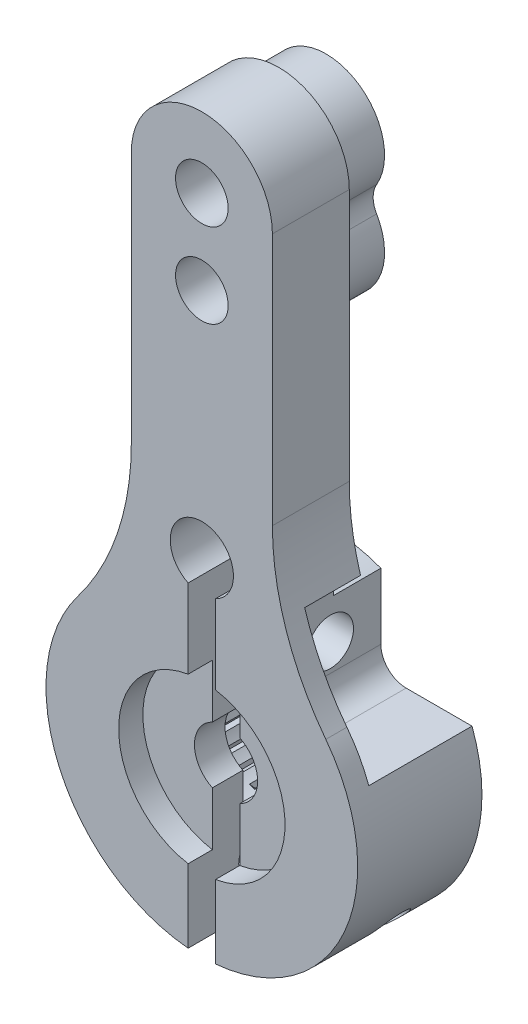
from build123d import *
from build123d.topology import SkipClean

# Parameters (mm, degrees)
BOSS_EXTRUDE1_DEPTH         = 3.65
F_3_0_3_DIAMETER_HOLE1_D    = 3
TAP_DRILL_FOR_M3X0_5_TAP1_D = 2.5
BOSS_EXTRUDE3_START         = 2.25
SKETCH10_R                  = 1.5
BOSS_EXTRUDE3_DEPTH         = 2.25
SKETCH9_W                   = 1.3
SKETCH9_H                   = 16.740891064
CUT_EXTRUDE2_DEPTH          = 29.941190369
SKETCH11_W                  = 6.665728158
SKETCH11_H                  = 5.8
CUT_EXTRUDE3_DEPTH          = 4.9
CIRPATTERN3_COUNT           = 2
M2_CLEARANCE_HOLE1_D        = 2.2
M2_CLEARANCE_HOLE1_DEPTH    = 1.95
M2_CLEARANCE_HOLE2_D        = 2.2
M2_CLEARANCE_HOLE2_DEPTH    = 1.95
TAP_DRILL_FOR_M2X0_4_TAP1_D = 1.6
TAP_DRILL_FOR_M2X0_4_TAP2_D = 1.6
FILLET3_R                   = 1.2
SKETCH8_R                   = 3.95
CUT_EXTRUDE1_DEPTH          = 1.15
SKETCH17_R                  = 2.95
BOSS_EXTRUDE4_DEPTH         = 3.3
BOSS_EXTRUDE5_DEPTH         = 3
DRAFT2_ANGLE                = -45
CIRPATTERN4_COUNT           = 25
FILLET4_R                   = 1.2


with BuildPart() as part:
    # Sketch1 → Boss-Extrude1 (new body)
    with BuildSketch(Plane.XY):
        with BuildLine():
            Line((-3.35, 24), (-3.35, 12))
            ThreePointArc((-3.35, 12), (-4.001241595, 8.033856538), (-5.886575957, 4.484219386))
            ThreePointArc((-5.886575957, 4.484219386), (0, -7.4), (5.886575957, 4.484219386))
            ThreePointArc((5.886575957, 4.484219386), (4.001241595, 8.033856538), (3.35, 12))
            Line((3.35, 12), (3.35, 24))
            ThreePointArc((3.35, 24), (0, 27.35), (-3.35, 24))
        make_face()
    extrude(amount=BOSS_EXTRUDE1_DEPTH)

    # Ø3.0 (3) Diameter Hole1 (through all)
    with Locations(Plane.XY.offset(3.65)):
        with Locations((0, 0), (0, 9)):
            Hole(F_3_0_3_DIAMETER_HOLE1_D / 2)

    # Tap Drill for M3x0.5 Tap1 (through all)
    with Locations(Plane.XY.offset(3.65)):
        with Locations((0, 24), (0, 20)):
            Hole(TAP_DRILL_FOR_M3X0_5_TAP1_D / 2)

    # Sketch10 → Boss-Extrude3 (add)
    # profile 1 of 7: a face of its own
    with SkipClean():  # the faces are left unmerged after this step: merging them gives an invalid solid
        with BuildSketch(Plane(origin=(0, 0, 0), x_dir=(-1, 0, 0), z_dir=(0, 0, -1)).offset(BOSS_EXTRUDE3_START)):
            with BuildLine():
                ThreePointArc((-1.92370086, 22), (-1.132337986, 22.53346318), (-0.207040964, 22.767265625))
                ThreePointArc((-0.207040964, 22.767265625), (-0.807371908, 24.954280149), (1.25, 24))
                ThreePointArc((1.25, 24), (0.954280149, 23.192628092), (0.207040964, 22.767265625))
                ThreePointArc((0.207040964, 22.767265625), (1.132337986, 22.53346318), (1.92370086, 22))
                ThreePointArc((1.92370086, 22), (2.553320866, 22.913180072), (2.775, 24))
                ThreePointArc((2.775, 24), (0, 26.775), (-2.775, 24))
                ThreePointArc((-2.775, 24), (-2.553320866, 22.913180072), (-1.92370086, 22))
            make_face()
        # profile 2 of 7: a face of its own
        with BuildSketch(Plane(origin=(0, 0, 0), x_dir=(-1, 0, 0), z_dir=(0, 0, -1)).offset(BOSS_EXTRUDE3_START)):
            with BuildLine():
                ThreePointArc((-0.207040964, 21.232734375), (-1.132337986, 21.46653682), (-1.92370086, 22))
                ThreePointArc((-1.92370086, 22), (-2.553320866, 21.086819928), (-2.775, 20))
                ThreePointArc((-2.775, 20), (0, 17.225), (2.775, 20))
                ThreePointArc((2.775, 20), (2.553320866, 21.086819928), (1.92370086, 22))
                ThreePointArc((1.92370086, 22), (1.132337986, 21.46653682), (0.207040964, 21.232734375))
                ThreePointArc((0.207040964, 21.232734375), (0.954280149, 20.807371908), (1.25, 20))
                ThreePointArc((1.25, 20), (-0.807371908, 19.045719851), (-0.207040964, 21.232734375))
            make_face()
        # profile 3 of 7: a face of its own
        with BuildSketch(Plane(origin=(0, 0, 0), x_dir=(-1, 0, 0), z_dir=(0, 0, -1)).offset(BOSS_EXTRUDE3_START)):
            with BuildLine():
                ThreePointArc((0.207040964, 22.767265625), (0.103879813, 22.754323885), (0, 22.75))
                Line((0, 22.75), (0, 21.25))
                ThreePointArc((0, 21.25), (0.103879813, 21.245676115), (0.207040964, 21.232734375))
                ThreePointArc((0.207040964, 21.232734375), (1.132337986, 21.46653682), (1.92370086, 22))
                ThreePointArc((1.92370086, 22), (1.132337986, 22.53346318), (0.207040964, 22.767265625))
            make_face()
        # profile 4 of 7: a face of its own
        with BuildSketch(Plane(origin=(0, 0, 0), x_dir=(-1, 0, 0), z_dir=(0, 0, -1)).offset(BOSS_EXTRUDE3_START)):
            with BuildLine():
                Line((0, 21.25), (0, 22.75))
                ThreePointArc((0, 22.75), (-0.103879813, 22.754323885), (-0.207040964, 22.767265625))
                ThreePointArc((-0.207040964, 22.767265625), (-1.132337986, 22.53346318), (-1.92370086, 22))
                ThreePointArc((-1.92370086, 22), (-1.132337986, 21.46653682), (-0.207040964, 21.232734375))
                ThreePointArc((-0.207040964, 21.232734375), (-0.103879813, 21.245676115), (0, 21.25))
            make_face()
        # profile 5 of 7: a face of its own
        with BuildSketch(Plane(origin=(0, 0, 0), x_dir=(-1, 0, 0), z_dir=(0, 0, -1)).offset(BOSS_EXTRUDE3_START)):
            with BuildLine():
                ThreePointArc((0.207040964, 22.767265625), (0.103879813, 22.754323885), (0, 22.75))
                Line((0, 22.75), (0, 21.25))
                ThreePointArc((0, 21.25), (0.103879813, 21.245676115), (0.207040964, 21.232734375))
                ThreePointArc((0.207040964, 21.232734375), (1.132337986, 21.46653682), (1.92370086, 22))
                ThreePointArc((1.92370086, 22), (1.132337986, 22.53346318), (0.207040964, 22.767265625))
            make_face()
        # profile 6 of 7: a face of its own
        with BuildSketch(Plane(origin=(0, 0, 0), x_dir=(-1, 0, 0), z_dir=(0, 0, -1)).offset(BOSS_EXTRUDE3_START)):
            with BuildLine():
                Line((0, 21.25), (0, 22.75))
                ThreePointArc((0, 22.75), (-0.103879813, 22.754323885), (-0.207040964, 22.767265625))
                ThreePointArc((-0.207040964, 22.767265625), (-1.132337986, 22.53346318), (-1.92370086, 22))
                ThreePointArc((-1.92370086, 22), (-1.132337986, 21.46653682), (-0.207040964, 21.232734375))
                ThreePointArc((-0.207040964, 21.232734375), (-0.103879813, 21.245676115), (0, 21.25))
            make_face()
        # profile 7 of 7: a face of its own
        with BuildSketch(Plane(origin=(0, 0, 0), x_dir=(-1, 0, 0), z_dir=(0, 0, -1)).offset(BOSS_EXTRUDE3_START)):
            with BuildLine():
                ThreePointArc((-5.886575957, 4.484219386), (-2.366361967, -7.011442865), (7.4, 0))
                ThreePointArc((7.4, 0), (7.011442865, 2.366361967), (5.886575957, 4.484219386))
                ThreePointArc((5.886575957, 4.484219386), (0, 7.4), (-5.886575957, 4.484219386))
            make_face()
            with Locations(Location((0, 0, 0), (0, 0, 180))):
                Circle(SKETCH10_R, mode=Mode.SUBTRACT)
        extrude(amount=-BOSS_EXTRUDE3_DEPTH)

    # Sketch9 → Cut-Extrude2 (cut, through all)
    with SkipClean():  # the faces are left unmerged after this step: merging them gives an invalid solid
        with BuildSketch(Plane.XY.offset(3.65)):
            Rectangle(SKETCH9_W, SKETCH9_H)
        extrude(amount=-CUT_EXTRUDE2_DEPTH, mode=Mode.SUBTRACT)

    # Sketch11 → Cut-Extrude3 (cut)
    with SkipClean():  # the faces are left unmerged after this step: merging them gives an invalid solid
        with BuildSketch(Plane(origin=(0, 0, -2.25), x_dir=(-1, 0, 0), z_dir=(0, 0, -1))):
            with Locations((-5.932864079, 5.5)):
                Rectangle(SKETCH11_W, SKETCH11_H)
        cut_extrude3 = extrude(amount=-CUT_EXTRUDE3_DEPTH, mode=Mode.SUBTRACT)

    # CirPattern3: Cut-Extrude3 ×2 about axis
    with SkipClean():  # the faces are left unmerged after this step: merging them gives an invalid solid
        cirpattern3_axis = Axis((0, 0, 0), (0, 0, 1))
        for i in range(1, CIRPATTERN3_COUNT):
            add(cut_extrude3.rotate(cirpattern3_axis, i * 360 / CIRPATTERN3_COUNT), mode=Mode.SUBTRACT)

    # M2 Clearance Hole1
    with Locations(Plane(origin=(2.6, 0, 0), x_dir=(0, 0, -1), z_dir=(1, 0, 0))):
        with Locations((-0.15, 5.1)):
            Hole(M2_CLEARANCE_HOLE1_D / 2, depth=M2_CLEARANCE_HOLE1_DEPTH)

    # M2 Clearance Hole2
    with Locations(Plane.ZY.offset(2.6)):
        with Locations((0.15, -5.1)):
            Hole(M2_CLEARANCE_HOLE2_D / 2, depth=M2_CLEARANCE_HOLE2_DEPTH)

    # Tap Drill for M2x0.4 Tap1 (through all)
    with Locations(Plane(origin=(-0.65, 0, 0), x_dir=(0, 0, -1), z_dir=(1, 0, 0))):
        with Locations((-0.15, 5.1)):
            Hole(TAP_DRILL_FOR_M2X0_4_TAP1_D / 2)

    # Tap Drill for M2x0.4 Tap2 (through all)
    with Locations(Plane.ZY.offset(-0.65)):
        with Locations((0.15, -5.1)):
            Hole(TAP_DRILL_FOR_M2X0_4_TAP2_D / 2)

    # Fillet3
    fillet3_edges = [part.edges().sort_by_distance(p)[0] for p in [
        (2.6, 2.6, 0.2),
        (2.6, 8.4, 1.325),
        (-2.6, -2.6, 0.2),
    ]]
    fillet(fillet3_edges, radius=FILLET3_R)

    # Sketch8 → Cut-Extrude1 (cut)
    with SkipClean():  # the faces are left unmerged after this step: merging them gives an invalid solid
        with BuildSketch(Plane.XY.offset(3.65)):
            Circle(SKETCH8_R)
        extrude(amount=-CUT_EXTRUDE1_DEPTH, mode=Mode.SUBTRACT)


with BuildPart() as body_2:
    # Sketch17 → Boss-Extrude4 (new body)
    with BuildSketch(Plane(origin=(0, 0, -2.25), x_dir=(-1, 0, 0), z_dir=(0, 0, -1))):
        Circle(SKETCH17_R)
    extrude(amount=-BOSS_EXTRUDE4_DEPTH)


with BuildPart() as body_3:
    # Sketch24 → Boss-Extrude5 (new body)
    with BuildSketch(Plane(origin=(0, 0, -2.25), x_dir=(-1, 0, 0), z_dir=(0, 0, -1))):
        Polygon((-0.040439856, 3.174742449), (-0.521537784, 2.341456395), (0.440658072, 2.341456395), align=None)
    extrude(amount=-BOSS_EXTRUDE5_DEPTH)

    # Draft2
    draft2_faces = [body_3.faces().sort_by_distance(p)[0] for p in [
        (0.040439856, 2.619218413, 0.75),
    ]]
    draft(draft2_faces, Plane(origin=(0.521537784, 2.341456395, 0.75), x_dir=(0, 0, -1), z_dir=(0, -1, 0)), DRAFT2_ANGLE)


with BuildPart() as cirpattern4_1:
    # CirPattern4: pattern copy
    add(body_3.part.rotate(Axis((0, 0, 0), (0, 0, 1)), 1 * 360 / CIRPATTERN4_COUNT))


with BuildPart() as cirpattern4_2:
    # CirPattern4: pattern copy
    add(body_3.part.rotate(Axis((0, 0, 0), (0, 0, 1)), 2 * 360 / CIRPATTERN4_COUNT))


with BuildPart() as cirpattern4_3:
    # CirPattern4: pattern copy
    add(body_3.part.rotate(Axis((0, 0, 0), (0, 0, 1)), 3 * 360 / CIRPATTERN4_COUNT))


with BuildPart() as cirpattern4_4:
    # CirPattern4: pattern copy
    add(body_3.part.rotate(Axis((0, 0, 0), (0, 0, 1)), 4 * 360 / CIRPATTERN4_COUNT))


with BuildPart() as cirpattern4_5:
    # CirPattern4: pattern copy
    add(body_3.part.rotate(Axis((0, 0, 0), (0, 0, 1)), 5 * 360 / CIRPATTERN4_COUNT))


with BuildPart() as cirpattern4_6:
    # CirPattern4: pattern copy
    add(body_3.part.rotate(Axis((0, 0, 0), (0, 0, 1)), 6 * 360 / CIRPATTERN4_COUNT))


with BuildPart() as cirpattern4_7:
    # CirPattern4: pattern copy
    add(body_3.part.rotate(Axis((0, 0, 0), (0, 0, 1)), 7 * 360 / CIRPATTERN4_COUNT))


with BuildPart() as cirpattern4_8:
    # CirPattern4: pattern copy
    add(body_3.part.rotate(Axis((0, 0, 0), (0, 0, 1)), 8 * 360 / CIRPATTERN4_COUNT))


with BuildPart() as cirpattern4_9:
    # CirPattern4: pattern copy
    add(body_3.part.rotate(Axis((0, 0, 0), (0, 0, 1)), 9 * 360 / CIRPATTERN4_COUNT))


with BuildPart() as cirpattern4_10:
    # CirPattern4: pattern copy
    add(body_3.part.rotate(Axis((0, 0, 0), (0, 0, 1)), 10 * 360 / CIRPATTERN4_COUNT))


with BuildPart() as cirpattern4_11:
    # CirPattern4: pattern copy
    add(body_3.part.rotate(Axis((0, 0, 0), (0, 0, 1)), 11 * 360 / CIRPATTERN4_COUNT))


with BuildPart() as cirpattern4_12:
    # CirPattern4: pattern copy
    add(body_3.part.rotate(Axis((0, 0, 0), (0, 0, 1)), 12 * 360 / CIRPATTERN4_COUNT))


with BuildPart() as cirpattern4_13:
    # CirPattern4: pattern copy
    add(body_3.part.rotate(Axis((0, 0, 0), (0, 0, 1)), 13 * 360 / CIRPATTERN4_COUNT))


with BuildPart() as cirpattern4_14:
    # CirPattern4: pattern copy
    add(body_3.part.rotate(Axis((0, 0, 0), (0, 0, 1)), 14 * 360 / CIRPATTERN4_COUNT))


with BuildPart() as cirpattern4_15:
    # CirPattern4: pattern copy
    add(body_3.part.rotate(Axis((0, 0, 0), (0, 0, 1)), 15 * 360 / CIRPATTERN4_COUNT))


with BuildPart() as cirpattern4_16:
    # CirPattern4: pattern copy
    add(body_3.part.rotate(Axis((0, 0, 0), (0, 0, 1)), 16 * 360 / CIRPATTERN4_COUNT))


with BuildPart() as cirpattern4_17:
    # CirPattern4: pattern copy
    add(body_3.part.rotate(Axis((0, 0, 0), (0, 0, 1)), 17 * 360 / CIRPATTERN4_COUNT))


with BuildPart() as cirpattern4_18:
    # CirPattern4: pattern copy
    add(body_3.part.rotate(Axis((0, 0, 0), (0, 0, 1)), 18 * 360 / CIRPATTERN4_COUNT))


with BuildPart() as cirpattern4_19:
    # CirPattern4: pattern copy
    add(body_3.part.rotate(Axis((0, 0, 0), (0, 0, 1)), 19 * 360 / CIRPATTERN4_COUNT))


with BuildPart() as cirpattern4_20:
    # CirPattern4: pattern copy
    add(body_3.part.rotate(Axis((0, 0, 0), (0, 0, 1)), 20 * 360 / CIRPATTERN4_COUNT))


with BuildPart() as cirpattern4_21:
    # CirPattern4: pattern copy
    add(body_3.part.rotate(Axis((0, 0, 0), (0, 0, 1)), 21 * 360 / CIRPATTERN4_COUNT))


with BuildPart() as cirpattern4_22:
    # CirPattern4: pattern copy
    add(body_3.part.rotate(Axis((0, 0, 0), (0, 0, 1)), 22 * 360 / CIRPATTERN4_COUNT))


with BuildPart() as cirpattern4_23:
    # CirPattern4: pattern copy
    add(body_3.part.rotate(Axis((0, 0, 0), (0, 0, 1)), 23 * 360 / CIRPATTERN4_COUNT))


with BuildPart() as cirpattern4_24:
    # CirPattern4: pattern copy
    add(body_3.part.rotate(Axis((0, 0, 0), (0, 0, 1)), 24 * 360 / CIRPATTERN4_COUNT))


with BuildPart() as body_3_1:
    add(body_3.part)

    # Combine1: union CirPattern4_1, CirPattern4_2, CirPattern4_3, CirPattern4_4, CirPattern4_5, CirPattern4_6, CirPattern4_7, CirPattern4_8, CirPattern4_9, CirPattern4_10, CirPattern4_11, CirPattern4_12, CirPattern4_13, CirPattern4_14, CirPattern4_15, CirPattern4_16, CirPattern4_17, CirPattern4_18, CirPattern4_19, CirPattern4_20, CirPattern4_21, CirPattern4_22, CirPattern4_23, CirPattern4_24, body 2
    add(cirpattern4_1.part)
    add(cirpattern4_2.part)
    add(cirpattern4_3.part)
    add(cirpattern4_4.part)
    add(cirpattern4_5.part)
    add(cirpattern4_6.part)
    add(cirpattern4_7.part)
    add(cirpattern4_8.part)
    add(cirpattern4_9.part)
    add(cirpattern4_10.part)
    add(cirpattern4_11.part)
    add(cirpattern4_12.part)
    add(cirpattern4_13.part)
    add(cirpattern4_14.part)
    add(cirpattern4_15.part)
    add(cirpattern4_16.part)
    add(cirpattern4_17.part)
    add(cirpattern4_18.part)
    add(cirpattern4_19.part)
    add(cirpattern4_20.part)
    add(cirpattern4_21.part)
    add(cirpattern4_22.part)
    add(cirpattern4_23.part)
    add(cirpattern4_24.part)
    add(body_2.part)


with BuildPart() as part_1:
    add(part.part)

    # Combine2: cut body 3
    add(body_3_1.part, mode=Mode.SUBTRACT)

    # Fillet4
    fillet4_edges = [part_1.edges().sort_by_distance(p)[0] for p in [
        (-1.92370086, 22, -1.125),
        (1.92370086, 22, -1.125),
    ]]
    fillet(fillet4_edges, radius=FILLET4_R)


solid = part_1.part
